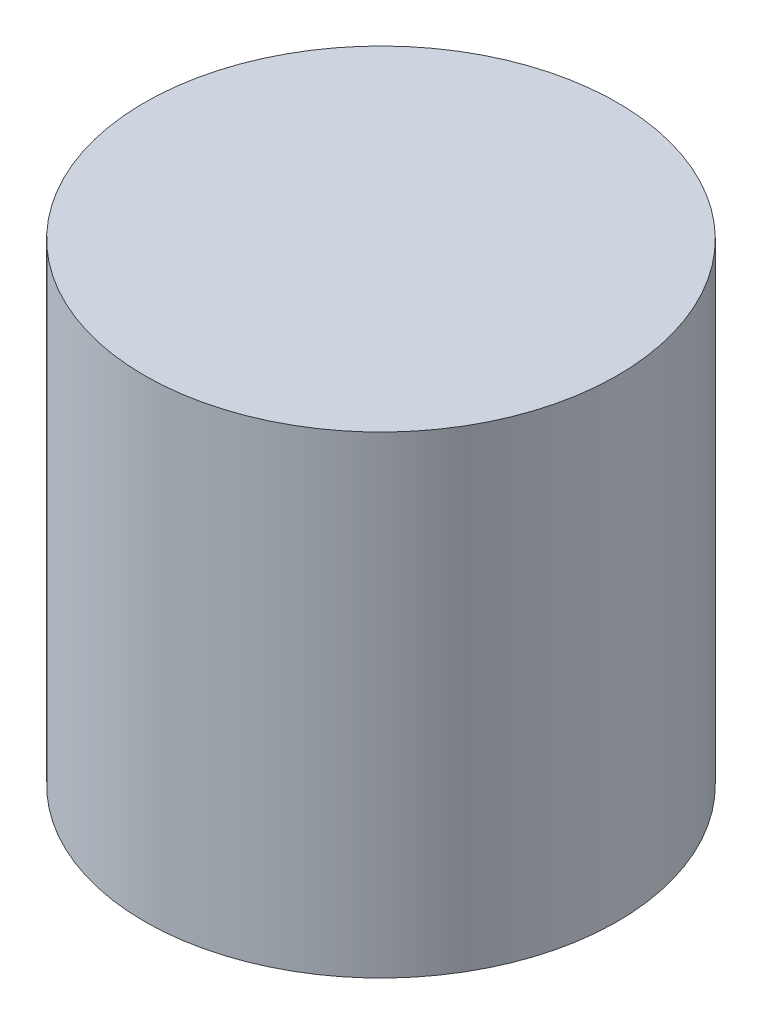
from build123d import *

# Parameters (mm, degrees)
SKETCH1_R           = 250
BOSS_EXTRUDE1_DEPTH = 500


with BuildPart() as part:
    # Sketch1 → Boss-Extrude1 (new body)
    with BuildSketch(Plane(origin=(0, 0, 0), x_dir=(1, 0, 0), z_dir=(0, 1, 0))):
        with Locations(Location((0, 0, 0), (0, 0, 270))):
            Circle(SKETCH1_R)
    extrude(amount=BOSS_EXTRUDE1_DEPTH)


solid = part.part
